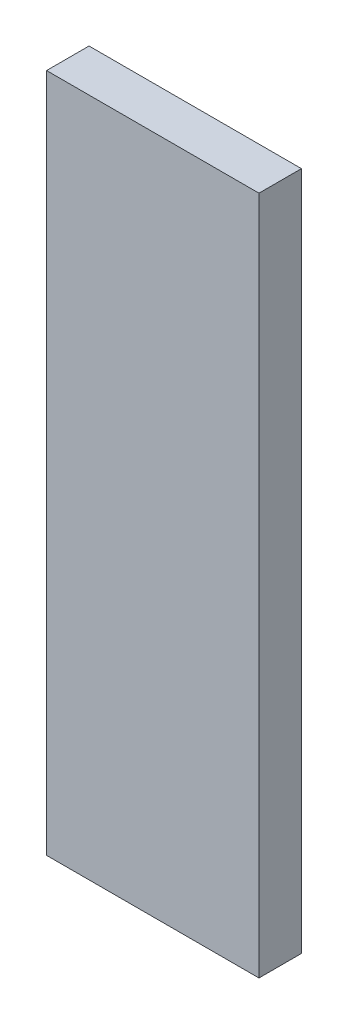
from build123d import *

# Parameters (mm, degrees)
SKETCH_1_W      = 50
SKETCH_1_H      = 160
EXTRUDE_1_DEPTH = 5


with BuildPart() as part:
    # 草图1 → 凸台-拉伸1 (new, symmetric)
    with BuildSketch(Plane.XY):
        Rectangle(SKETCH_1_W, SKETCH_1_H)
    extrude(amount=EXTRUDE_1_DEPTH, both=True)


solid = part.part
